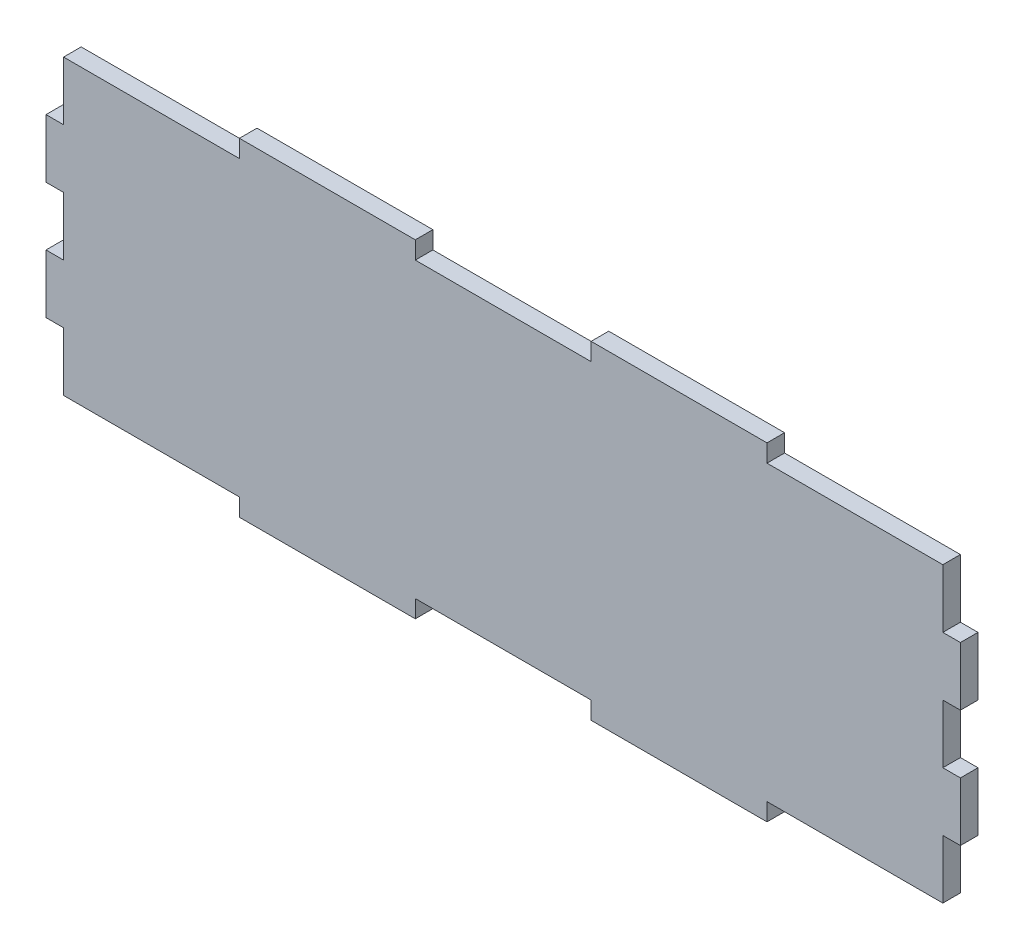
from build123d import *

# Parameters (mm, degrees)
RESSALTO_EXTRUS_O1_DEPTH = 3


with BuildPart() as part:
    # Esboço1 → Ressalto-extrusão1 (new body)
    with BuildSketch(Plane.XY):
        Polygon((-90, 33), (-90, 30), (-120, 30), (-120, 20), (-123, 20), (-123, 10), (-120, 10), (-120, 0), (-123, 0), (-123, -10), (-120, -10), (-120, -20), (-90, -20), (-90, -23), (-60, -23), (-60, -20), (-30, -20), (-30, -23), (0, -23), (0, -20), (30, -20), (30, -10), (33, -10), (33, 0), (30, 0), (30, 10), (33, 10), (33, 20), (30, 20), (30, 30), (0, 30), (0, 33), (-30, 33), (-30, 30), (-60, 30), (-60, 33), align=None)
    extrude(amount=RESSALTO_EXTRUS_O1_DEPTH)


solid = part.part
